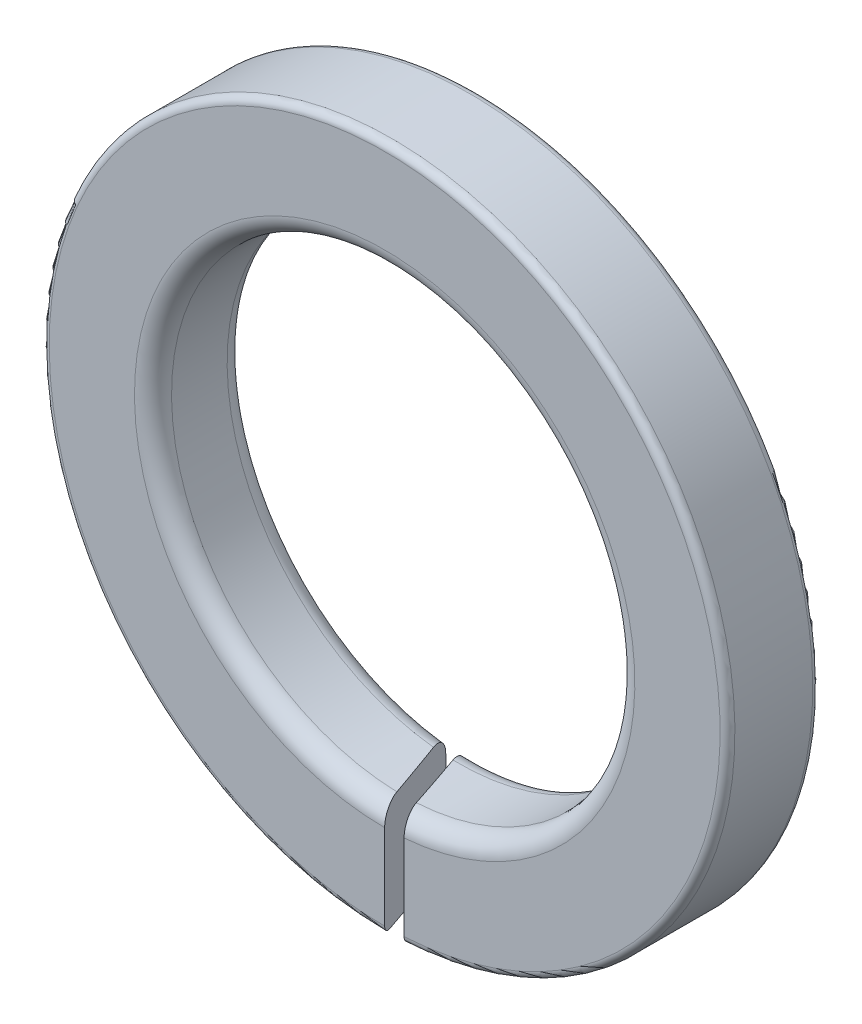
from build123d import *

# Parameters (mm, degrees)
ESQUISSE1_R             = 9.25
ESQUISSE1_R_2           = 6.25
EXTRUSION1_DEPTH        = 2.5
ENL_V_MAT_EXTRU_1_DEPTH = 14.318220602
CONG_1_R                = 0.5
CONG_2_R                = 0.2


with BuildPart() as part:
    # Esquisse1 → Extrusion1 (new body)
    with BuildSketch(Plane.XY):
        Circle(ESQUISSE1_R)
        Circle(ESQUISSE1_R_2, mode=Mode.SUBTRACT)
    extrude(amount=EXTRUSION1_DEPTH)

    # Esquisse2 → Enlèv. mat.-Extru.1 (cut, through all)
    with BuildSketch(Plane(origin=(0, 0, 0), x_dir=(1, 0, 0), z_dir=(0, 1, 0))):
        Polygon((-0.851663401, 0), (0, -2.5), (0.524617445, -2.5), (-0.327045957, 0), align=None)
    extrude(amount=-ENL_V_MAT_EXTRU_1_DEPTH, mode=Mode.SUBTRACT)

    # Congé1
    cong_1_edges = [part.edges().sort_by_distance(p)[0] for p in [
        (-4.419417382, 4.419417382, 2.5),
        (-4.107286436, 4.710912664, 0),
    ]]
    fillet(cong_1_edges, radius=CONG_1_R)

    # Congé2
    cong_2_edges = [part.edges().sort_by_distance(p)[0] for p in [
        (-6.540737726, 6.540737726, 2.5),
        (-6.232359647, 6.835217131, 0),
    ]]
    fillet(cong_2_edges, radius=CONG_2_R)


solid = part.part
